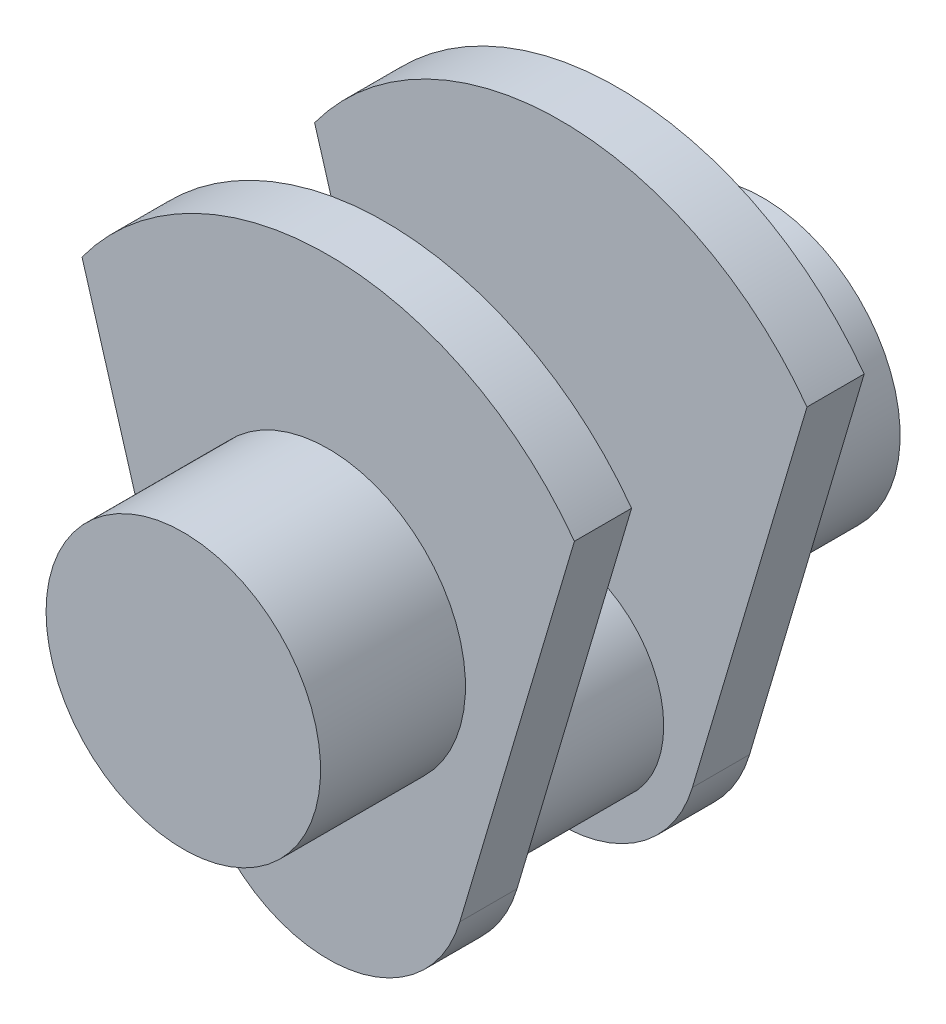
from build123d import *

# Parameters (mm, degrees)
SKETCH1_R           = 36
BOSS_EXTRUDE1_DEPTH = 15
SKETCH2_R           = 27
BOSS_EXTRUDE2_DEPTH = 46
SKETCH3_R           = 36
BOSS_EXTRUDE3_DEPTH = 38


with BuildPart() as part:
    # Sketch1 → Boss-Extrude1 (new body)
    with BuildSketch(Plane.XY):
        with BuildLine():
            Line((-64.569893475, 47.23059238), (-34.517510455, -54.224552409))
            ThreePointArc((-34.517510455, -54.224552409), (-5.165734392, -8.372550074), (36, -44))
            ThreePointArc((36, -44), (35.627449926, -49.165734392), (34.517510455, -54.224552409))
            Line((34.517510455, -54.224552409), (64.569893475, 47.23059238))
            ThreePointArc((64.569893475, 47.23059238), (0, 80), (-64.569893475, 47.23059238))
        make_face()
        with Locations((0, -44)):
            Circle(SKETCH1_R)
    extrude(amount=BOSS_EXTRUDE1_DEPTH)

    # Sketch2 → Boss-Extrude2 (add)
    with BuildSketch(Plane.XY.offset(15)):
        with Locations((0, -44)):
            Circle(SKETCH2_R)
    extrude(amount=BOSS_EXTRUDE2_DEPTH)

    # Sketch3 → Boss-Extrude3 (add)
    with BuildSketch(Plane(origin=(0, 0, 0), x_dir=(-1, 0, 0), z_dir=(0, 0, -1))):
        Circle(SKETCH3_R)
    extrude(amount=BOSS_EXTRUDE3_DEPTH)

    # Mirror1: part across plane


with BuildPart() as part_1:
    add(part.part)
    add(part.part.mirror(Plane.XY.offset(38)))


solid = part_1.part
